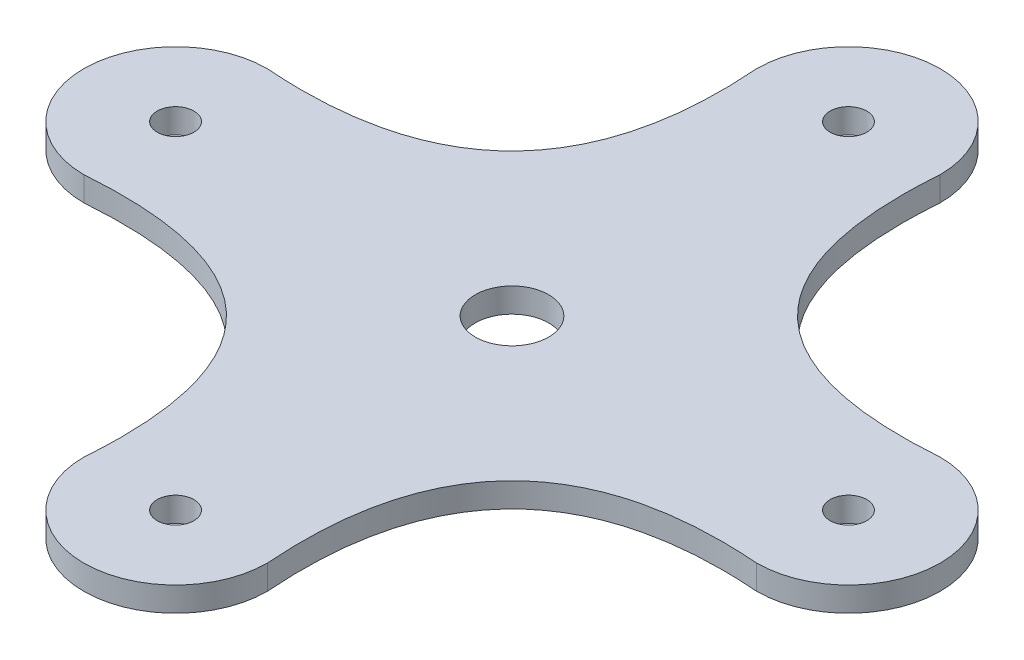
from build123d import *

# Parameters (mm, degrees)
SKETCH1_R           = 1.5
SKETCH1_R_2         = 3
BOSS_EXTRUDE1_DEPTH = 2


with BuildPart() as part:
    # Sketch1 → Boss-Extrude1 (new body)
    with BuildSketch(Plane(origin=(0, 0, 0), x_dir=(1, 0, 0), z_dir=(0, 1, 0))):
        with BuildLine():
            ThreePointArc((27.5, -7.5), (35, 0), (27.5, 7.5))
            add(Edge.make_bspline(
                [(27.5, 7.5), (5.834523779, 5.834523779), (7.5, 27.5)],
                knots=[0, 0, 0, 1, 1, 1], degree=2))
            ThreePointArc((7.5, 27.5), (0, 35), (-7.5, 27.5))
            add(Edge.make_bspline(
                [(-7.5, 27.5), (-5.834523779, 5.834523779), (-27.5, 7.5)],
                knots=[0, 0, 0, 1, 1, 1], degree=2))
            ThreePointArc((-27.5, 7.5), (-35, 0), (-27.5, -7.5))
            add(Edge.make_bspline(
                [(-27.5, -7.5), (-5.834523779, -5.834523779), (-7.5, -27.5)],
                knots=[0, 0, 0, 1, 1, 1], degree=2))
            ThreePointArc((-7.5, -27.5), (0, -35), (7.5, -27.5))
            add(Edge.make_bspline(
                [(7.5, -27.5), (5.834523779, -5.834523779), (27.5, -7.5)],
                knots=[0, 0, 0, 1, 1, 1], degree=2))
        make_face()
        with Locations(Location((0, 27.5, 0), (0, 0, 270))):
            Circle(SKETCH1_R, mode=Mode.SUBTRACT)
        with Locations(Location((-27.5, 0, 0), (0, 0, 270))):
            Circle(SKETCH1_R, mode=Mode.SUBTRACT)
        with Locations(Location((27.5, 0, 0), (0, 0, 270))):
            Circle(SKETCH1_R, mode=Mode.SUBTRACT)
        with Locations(Location((0, -27.5, 0), (0, 0, 270))):
            Circle(SKETCH1_R, mode=Mode.SUBTRACT)
        with Locations(Location((0, 0, 0), (0, 0, 270))):
            Circle(SKETCH1_R_2, mode=Mode.SUBTRACT)
    extrude(amount=BOSS_EXTRUDE1_DEPTH)


solid = part.part
